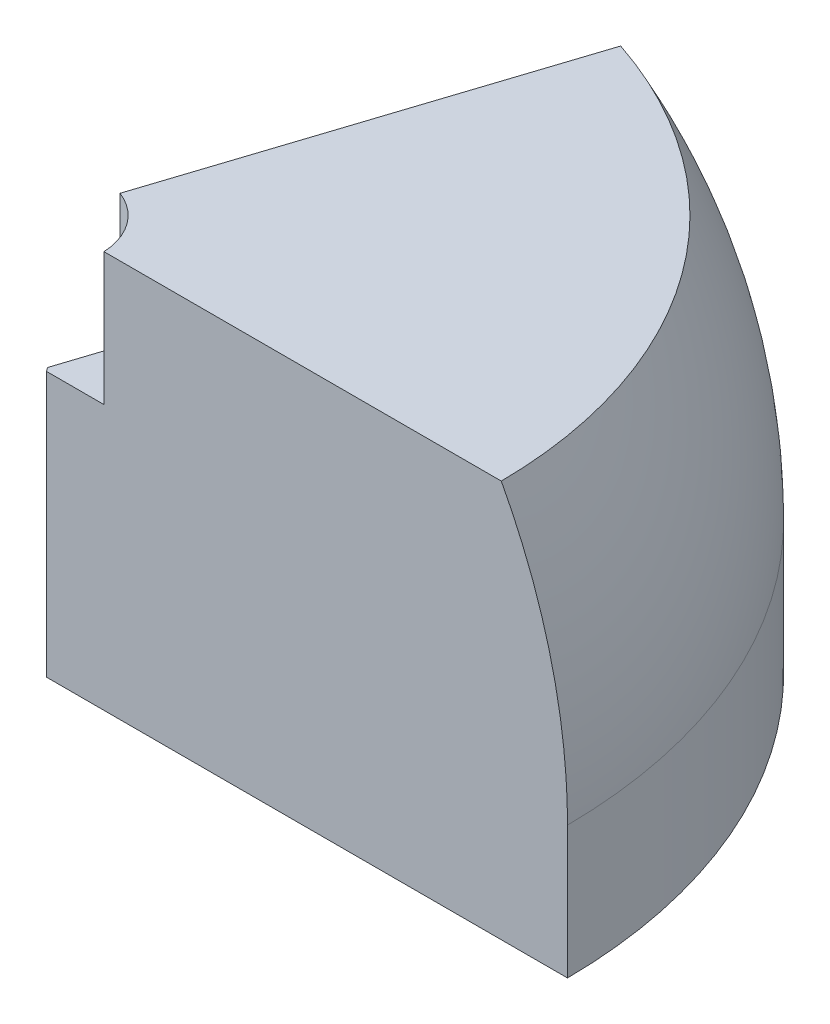
from build123d import *

# Parameters (mm, degrees)
REVOLVE1_ANGLE     = 72
CUT_EXTRUDE2_DEPTH = 0.635
CUT_EXTRUDE3_DEPTH = 0.635
SKETCH2_R          = 12.7
CUT_EXTRUDE1_DEPTH = 25.4
CUT_EXTRUDE4_REACH = 151.001


with BuildPart() as part:
    # Sketch1 → Revolve1 (revolve)
    with BuildSketch(Plane.XY):
        with BuildLine():
            Line((0, 0), (0, 76.2))
            Line((0, 76.2), (88.9, 76.2))
            ThreePointArc((88.9, 76.2), (98.376882891, 51.581720723), (101.6, 25.4))
            Line((101.6, 25.4), (101.6, 0))
            Line((101.6, 0), (0, 0))
        make_face()
    revolve(axis=Axis((0, 0, 0), (0, 1, 0)), revolution_arc=REVOLVE1_ANGLE)

    # Sketch3 → Cut-Extrude2 (cut)
    with BuildSketch(Plane(origin=(0, 0, 0), x_dir=(-0.3090169943749449, 0, 0.9510565162951544), z_dir=(-0.9510565162951544, 0, -0.3090169943749449))):
        with BuildLine():
            Line((0, 76.2), (-88.9, 76.2))
            ThreePointArc((-88.9, 76.2), (-98.376882891, 51.581720723), (-101.6, 25.4))
            Line((-101.6, 25.4), (-101.6, 0))
            Line((-101.6, 0), (0, 0))
            Line((0, 0), (0, 76.2))
        make_face()
    extrude(amount=-CUT_EXTRUDE2_DEPTH, mode=Mode.SUBTRACT)

    # Sketch4 → Cut-Extrude3 (cut)
    with BuildSketch(Plane.XY):
        with BuildLine():
            Line((0.667678512, 76.2), (0.667678512, 0))
            Line((0.667678512, 0), (101.6, 0))
            Line((101.6, 0), (101.6, 25.4))
            ThreePointArc((101.6, 25.4), (98.376882891, 51.581720723), (88.9, 76.2))
            Line((88.9, 76.2), (0.667678512, 76.2))
        make_face()
    extrude(amount=-CUT_EXTRUDE3_DEPTH, mode=Mode.SUBTRACT)

    # Sketch2 → Cut-Extrude1 (cut)
    with BuildSketch(Plane(origin=(0, 76.2, 0), x_dir=(1, 0, 0), z_dir=(0, 1, 0))):
        Circle(SKETCH2_R)
    extrude(amount=-CUT_EXTRUDE1_DEPTH, mode=Mode.SUBTRACT)

    # Sketch5 → Cut-Extrude4 (cut, up to next)
    with BuildSketch(Plane(origin=(0, 50.8, 0), x_dir=(1, 0, 0), z_dir=(0, 1, 0)), mode=Mode.PRIVATE) as cut_extrude4_sk1:
        Polygon((1.658905685, 0.635), (1.116550937, 1.38148727), (0.874002519, 0.635), align=None)
    cut_extrude4_tool1 = extrude(cut_extrude4_sk1.sketch, amount=-CUT_EXTRUDE4_REACH, mode=Mode.PRIVATE) & part.part
    add(cut_extrude4_tool1.solids().sort_by_distance((1.216486, 50.8, -0.883829))[0], mode=Mode.SUBTRACT)


solid = part.part
